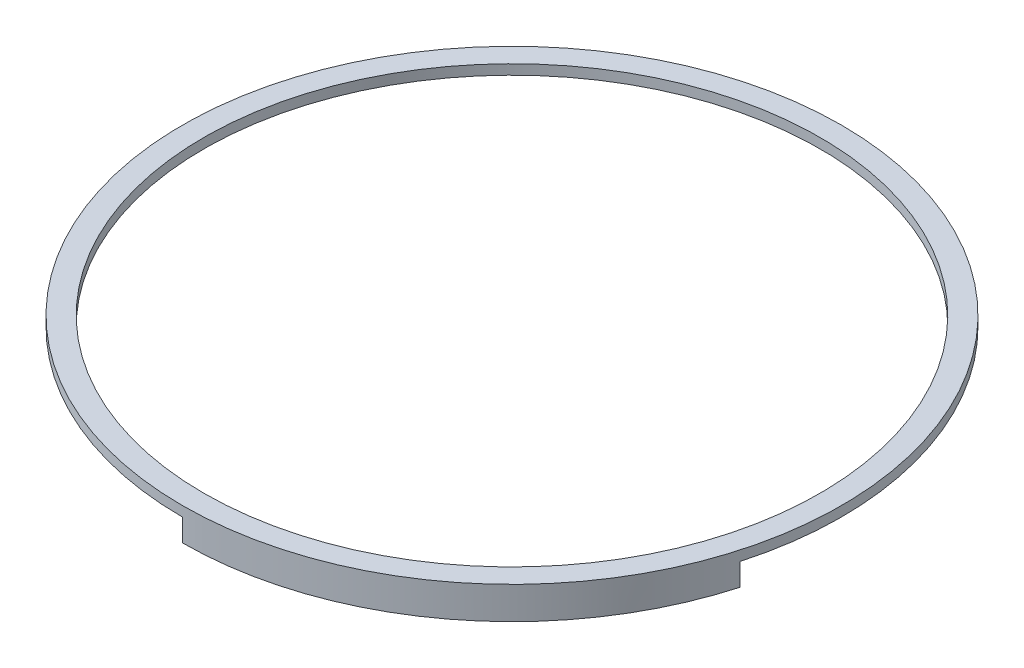
from build123d import *
from build123d.topology import SkipClean

# Parameters (mm, degrees)
SKETCH2_R           = 66.3
SKETCH2_R_2         = 62
BOSS_EXTRUDE1_DEPTH = 2
BOSS_EXTRUDE2_START = 4.5
BOSS_EXTRUDE2_DEPTH = 4.5


with BuildPart() as part:
    # Sketch2 → Boss-Extrude1 (new body)
    with BuildSketch(Plane(origin=(0, 0, 0), x_dir=(1, 0, 0), z_dir=(0, 1, 0))):
        with Locations(Location((0, 0, 0), (0, 0, 270))):
            Circle(SKETCH2_R)
        with Locations(Location((0, 0, 0), (0, 0, 270))):
            Circle(SKETCH2_R_2, mode=Mode.SUBTRACT)
    extrude(amount=BOSS_EXTRUDE1_DEPTH)

    # Sketch3 → Boss-Extrude2 (add)
    with SkipClean():  # the faces are left unmerged after this step: merging them gives an invalid solid
        with BuildSketch(Plane.XZ.offset(BOSS_EXTRUDE2_START)):
            with BuildLine():
                Line((0, 66.3), (0, 65.3))
                ThreePointArc((0, 65.3), (39.444144484, 52.040844209), (62.870033017, 17.647916262))
                Line((62.870033017, 17.647916262), (63.832820659, 17.918175317))
                ThreePointArc((63.832820659, 17.918175317), (40.048189575, 52.83779435), (0, 66.3))
            make_face()
        extrude(amount=-BOSS_EXTRUDE2_DEPTH)


solid = part.part
